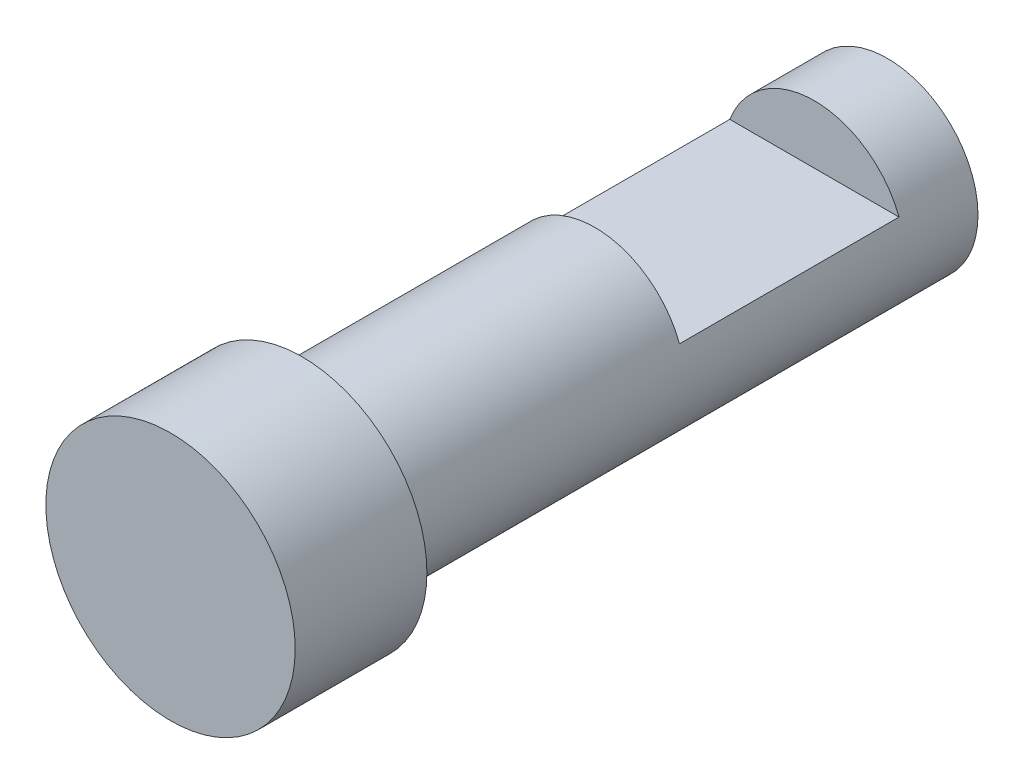
from build123d import *

# Parameters (mm, degrees)
SKETCH1_R           = 5.4102
BOSS_EXTRUDE1_DEPTH = 5.715
SKETCH2_R           = 3.9243
BOSS_EXTRUDE2_DEPTH = 25.4
SKETCH3_W           = 9.007282867
SKETCH3_H           = 9.525
CUT_EXTRUDE1_DEPTH  = 2.54


with BuildPart() as part:
    # Sketch1 → Boss-Extrude1 (new body)
    with BuildSketch(Plane.XY):
        Circle(SKETCH1_R)
    extrude(amount=BOSS_EXTRUDE1_DEPTH)

    # Sketch2 → Boss-Extrude2 (add)
    with BuildSketch(Plane(origin=(0, 0, 0), x_dir=(-1, 0, 0), z_dir=(0, 0, -1))):
        with Locations(Location((0, 0, 0), (0, 0, 180))):
            Circle(SKETCH2_R)
    extrude(amount=BOSS_EXTRUDE2_DEPTH)

    # Sketch3 → Cut-Extrude1 (cut)
    with BuildSketch(Plane(origin=(0, 3.9243, 0), x_dir=(1, 0, 0), z_dir=(0, 1, 0))):
        with Locations((-0.278552297, 17.4625)):
            Rectangle(SKETCH3_W, SKETCH3_H)
    extrude(amount=-CUT_EXTRUDE1_DEPTH, mode=Mode.SUBTRACT)


solid = part.part
